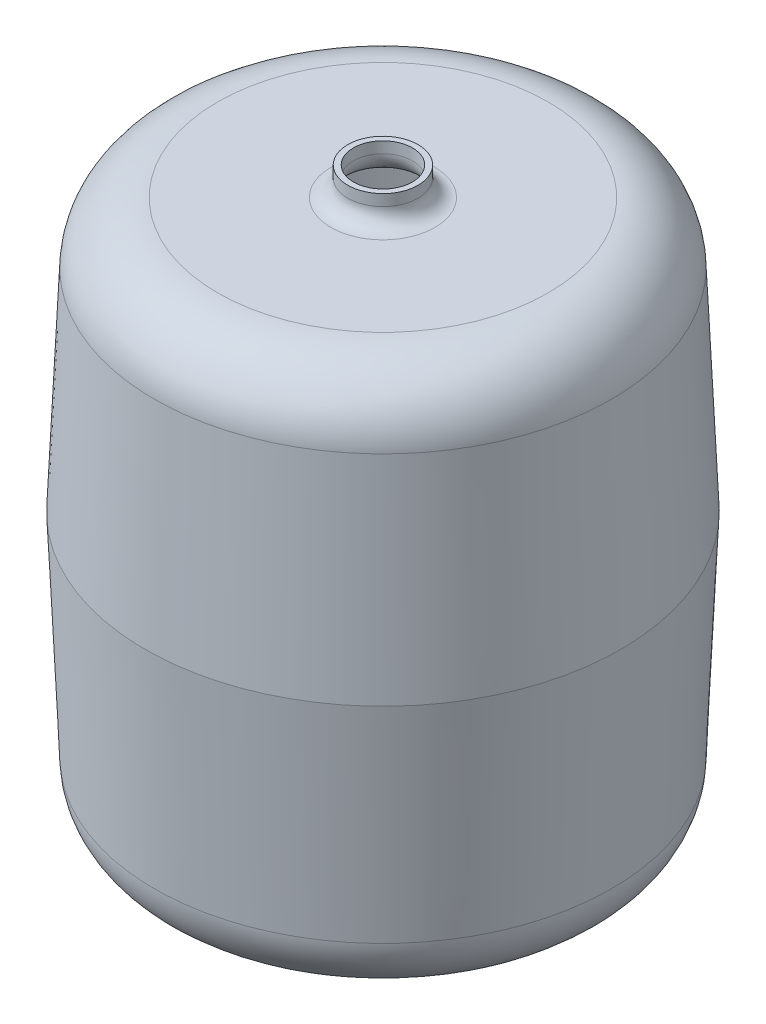
from build123d import *


with BuildPart() as part:
    # Sketch1 → Revolve1 (revolve)
    with BuildSketch(Plane.XY, mode=Mode.PRIVATE) as revolve1_sk:
        with BuildLine():
            Line((0, -193.75), (-117.542830029, -193.75))
            ThreePointArc((-117.542830029, -193.75), (-148.660917539, -181.256378293), (-162.5, -150.712872431))
            Line((-162.5, -150.712872431), (-169.080266119, 0))
            Line((-169.080266119, 0), (-162.5, 150.712872431))
            ThreePointArc((-162.5, 150.712872431), (-148.660917539, 181.256378293), (-117.542830029, 193.75))
            Line((-117.542830029, 193.75), (-37, 193.75))
            ThreePointArc((-37, 193.75), (-28.514718626, 197.264718626), (-25, 205.75))
            Line((-25, 205.75), (-25, 213.75))
            Line((-25, 213.75), (-21, 213.75))
            Line((-21, 213.75), (-21, 205.75))
            ThreePointArc((-21, 205.75), (-25.686291501, 194.436291501), (-37, 189.75))
            Line((-37, 189.75), (-117.542830029, 189.75))
            ThreePointArc((-117.542830029, 189.75), (-145.894865316, 178.366922444), (-158.503807114, 150.538394882))
            Line((-158.503807114, 150.538394882), (-165.076455378, 0))
            Line((-165.076455378, 0), (-158.503807114, -150.538394882))
            ThreePointArc((-158.503807114, -150.538394882), (-145.894865316, -178.366922444), (-117.542830029, -189.75))
            Line((-117.542830029, -189.75), (0, -189.75))
            Line((0, -189.75), (0, -193.75))
        make_face()
    revolve(revolve1_sk.sketch.rotate(Axis((0, 0, 0), (0, 1, 0)), 270), axis=Axis((0, 0, 0), (0, 1, 0)))


solid = part.part
